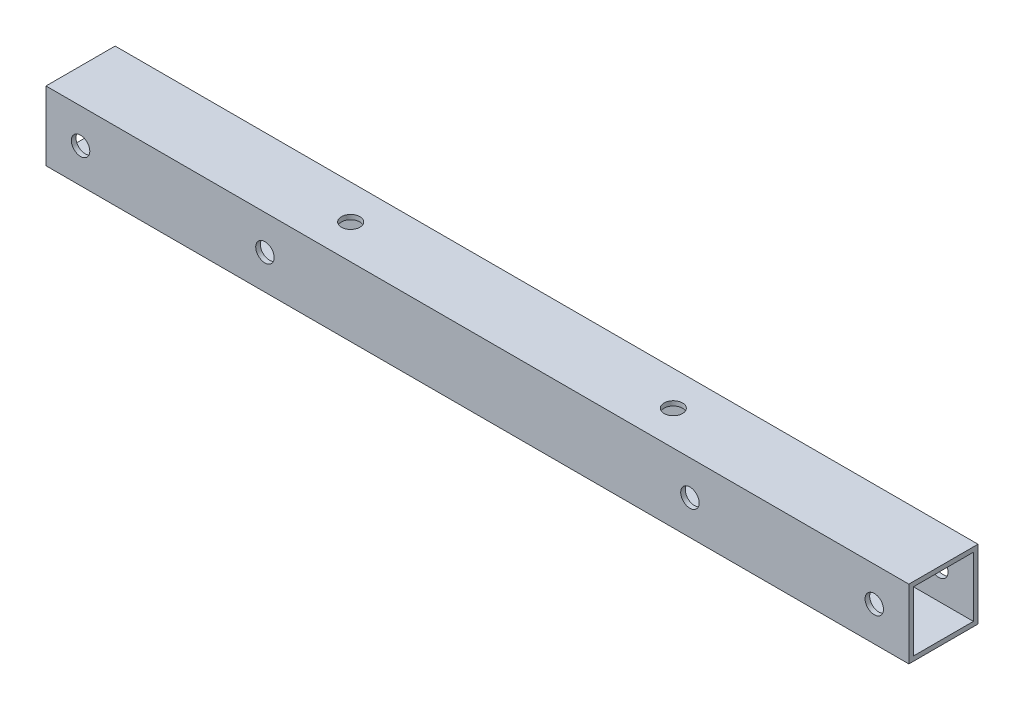
from build123d import *

# Parameters (mm, degrees)
SKETCH_1_W          = 15
SKETCH_1_H          = 15
SKETCH_1_W_2        = 13
SKETCH_1_H_2        = 13
EXTRUDE_1_DEPTH     = 187.2
SKETCH_2_R          = 2
CUT_EXTRUDE_1_DEPTH = 188.949700718
SKETCH_3_R          = 2
CUT_EXTRUDE_2_DEPTH = 188.949700718


with BuildPart() as part:
    # ｽｹｯﾁ1 → 押し出し-薄板1 (new body)
    with BuildSketch(Plane(origin=(0, 0, 0), x_dir=(0, 0, -1), z_dir=(1, 0, 0))):
        Rectangle(SKETCH_1_W, SKETCH_1_H)
        Rectangle(SKETCH_1_W_2, SKETCH_1_H_2, mode=Mode.SUBTRACT)
    extrude(amount=EXTRUDE_1_DEPTH)

    # ｽｹｯﾁ2 → ｶｯﾄ - 押し出し1 (cut, through all)
    with BuildSketch(Plane.XY.offset(7.5)):
        with Locations((7.5, 0)):
            Circle(SKETCH_2_R)
        with Locations((47.5, 0)):
            Circle(SKETCH_2_R)
        with Locations(Location((139.7, 0, 0), (0, 0, 180))):
            Circle(SKETCH_2_R)
        with Locations(Location((179.7, 0, 0), (0, 0, 180))):
            Circle(SKETCH_2_R)
    extrude(amount=-CUT_EXTRUDE_1_DEPTH, mode=Mode.SUBTRACT)

    # ｽｹｯﾁ3 → ｶｯﾄ - 押し出し2 (cut, through all)
    with BuildSketch(Plane(origin=(0, 7.5, 0), x_dir=(1, 0, 0), z_dir=(0, 1, 0))):
        with Locations(Location((58.6, 0, 0), (0, 0, 270))):
            Circle(SKETCH_3_R)
        with Locations(Location((128.6, 0, 0), (0, 0, 270))):
            Circle(SKETCH_3_R)
    extrude(amount=-CUT_EXTRUDE_2_DEPTH, mode=Mode.SUBTRACT)


solid = part.part
